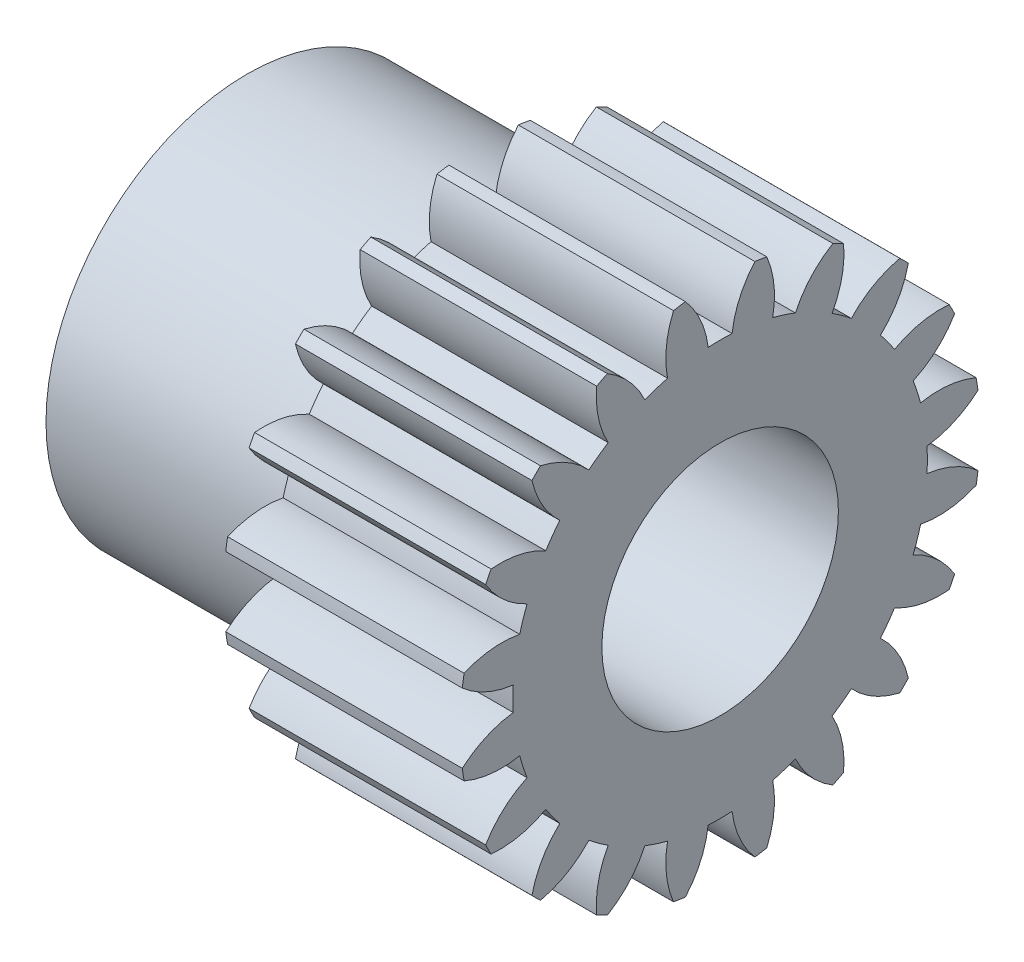
from build123d import *

# Parameters (mm, degrees)
BASPROSKE_W      = 12.7
BASPROSKE_H      = 13.97
TOOTHCUT_DEPTH   = 24.486417351
TEETHCUTS_COUNT  = 20
TEETHCUTS_ANGLE  = 342
HUBNEAONESKE_R   = 10.795
HUBNEARONE_DEPTH = 12.7000508
BORSKE_R         = 6.35
BORE_DEPTH       = 25.4000508


with BuildPart() as part:
    # BasProSke → Base-Revolve (revolve)
    with BuildSketch(Plane(origin=(0, 0, 0), x_dir=(1, 0, 0), z_dir=(0, 1, 0)), mode=Mode.PRIVATE) as base_revolve_sk:
        with Locations((6.35, 6.985)):
            Rectangle(BASPROSKE_W, BASPROSKE_H)
    revolve(base_revolve_sk.sketch.rotate(Axis((-10, 0, 0), (1, 0, 0)), 180), axis=Axis((-10, 0, 0), (1, 0, 0)))

    # TooCutSke → ToothCut (cut, through all)
    with BuildSketch(Plane(origin=(0, 0, 0), x_dir=(0, 0, -1), z_dir=(1, 0, 0))):
        with BuildLine():
            ThreePointArc((0.64046545, 11.106749257), (0, 11.1252), (-0.64046545, 11.106749257))
            ThreePointArc((-0.64046545, 11.106749257), (-1.052455812, 12.582227662), (-1.8855699, 13.867798935))
            ThreePointArc((-1.8855699, 13.867798935), (0, 13.9954), (1.8855699, 13.867798935))
            ThreePointArc((1.8855699, 13.867798935), (1.052455812, 12.582227662), (0.64046545, 11.106749257))
        make_face()
    toothcut = extrude(amount=TOOTHCUT_DEPTH, mode=Mode.SUBTRACT)

    # TeethCuts: ToothCut ×20 about axis
    teethcuts_axis = Axis((-10, 0, 0), (1, 0, 0))
    for i in range(1, TEETHCUTS_COUNT):
        add(toothcut.rotate(teethcuts_axis, i * TEETHCUTS_ANGLE / (TEETHCUTS_COUNT - 1)), mode=Mode.SUBTRACT)

    # HubNeaOneSke → HubNearOne (add)
    with BuildSketch(Plane.ZY):
        with Locations(Location((0, 0, 0), (0, 0, 180))):
            Circle(HUBNEAONESKE_R)
    extrude(amount=HUBNEARONE_DEPTH)

    # BorSke → Bore (cut, symmetric)
    with BuildSketch(Plane(origin=(0, 0, 0), x_dir=(0, 0, -1), z_dir=(1, 0, 0))):
        with Locations(Location((0, 0, 0), (0, 0, 180))):
            Circle(BORSKE_R)
    extrude(amount=BORE_DEPTH, both=True, mode=Mode.SUBTRACT)


solid = part.part
